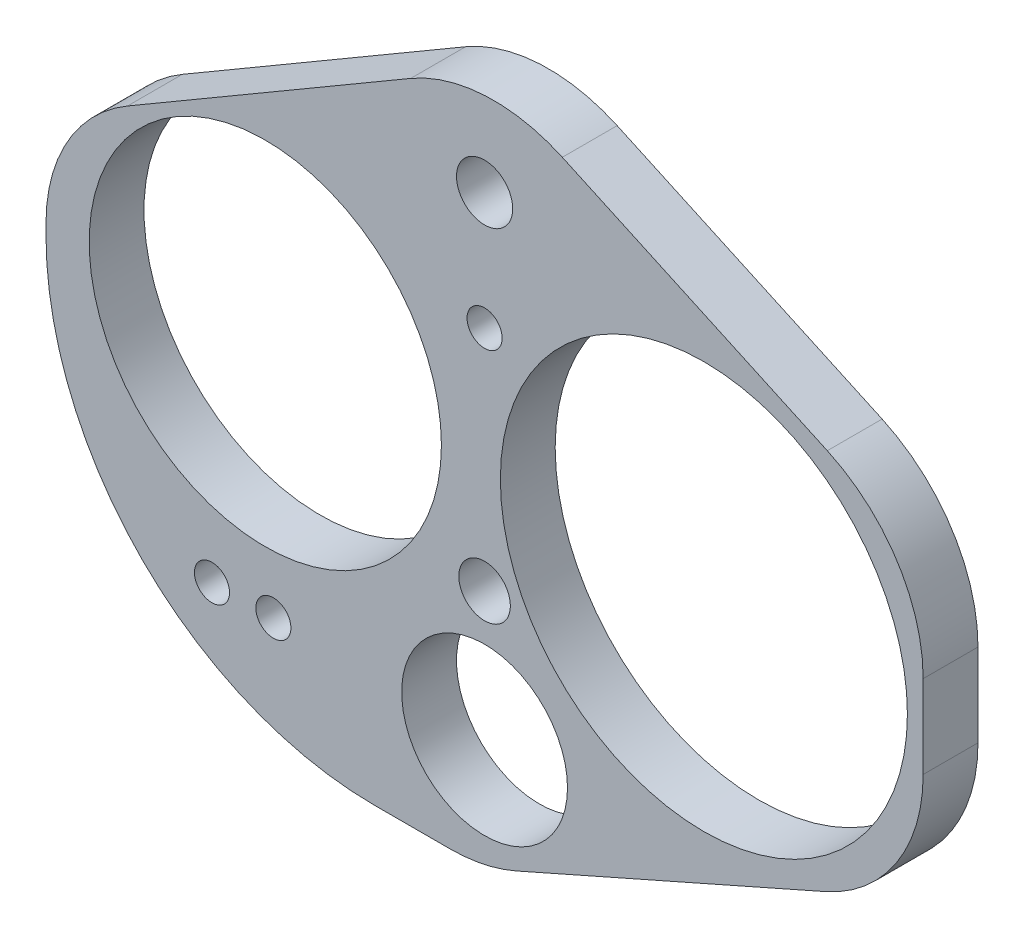
from build123d import *

# Parameters (mm, degrees)
SKETCH1_R           = 16.0625
SKETCH1_R_2         = 18.5625
SKETCH1_R_3         = 1.6
SKETCH1_R_4         = 2.35
SKETCH1_R_5         = 2.5625
SKETCH1_R_6         = 7.5625
BOSS_EXTRUDE1_DEPTH = 5
FILLET1_R           = 15
FILLET2_R           = 30


with BuildPart() as part:
    # Sketch1 → Boss-Extrude1 (new body)
    with BuildSketch(Plane.XY):
        Polygon((-20, -31.5), (20, -31.5), (60, -13.814957213), (60, 13.141793742), (20, 31.5), (-20, 8.126584262), align=None)
        Circle(SKETCH1_R, mode=Mode.SUBTRACT)
        with Locations((40, 0)):
            Circle(SKETCH1_R_2, mode=Mode.SUBTRACT)
        with Locations((20, 11.209005776)):
            Circle(SKETCH1_R_3, mode=Mode.SUBTRACT)
        with Locations((20, -9.557095977)):
            Circle(SKETCH1_R_4, mode=Mode.SUBTRACT)
        with Locations((20, 21.918567686)):
            Circle(SKETCH1_R_5, mode=Mode.SUBTRACT)
        with Locations((20, -21.316811866)):
            Circle(SKETCH1_R_6, mode=Mode.SUBTRACT)
        with Locations((0.737105173, -21.316811866)):
            Circle(SKETCH1_R_3, mode=Mode.SUBTRACT)
        with Locations((-4.862894827, -21.316811866)):
            Circle(SKETCH1_R_3, mode=Mode.SUBTRACT)
    extrude(amount=BOSS_EXTRUDE1_DEPTH)

    # Fillet1
    fillet1_edges = [part.edges().sort_by_distance(p)[0] for p in [
        (20, -31.5, 2.5),
        (-20, 8.126584262, 2.5),
        (20, 31.5, 2.5),
        (60, 13.141793742, 2.5),
        (60, -13.814957213, 2.5),
    ]]
    fillet(fillet1_edges, radius=FILLET1_R)

    # Fillet2
    fillet2_edges = [part.edges().sort_by_distance(p)[0] for p in [
        (-20, -31.5, 2.5),
    ]]
    fillet(fillet2_edges, radius=FILLET2_R)


solid = part.part
